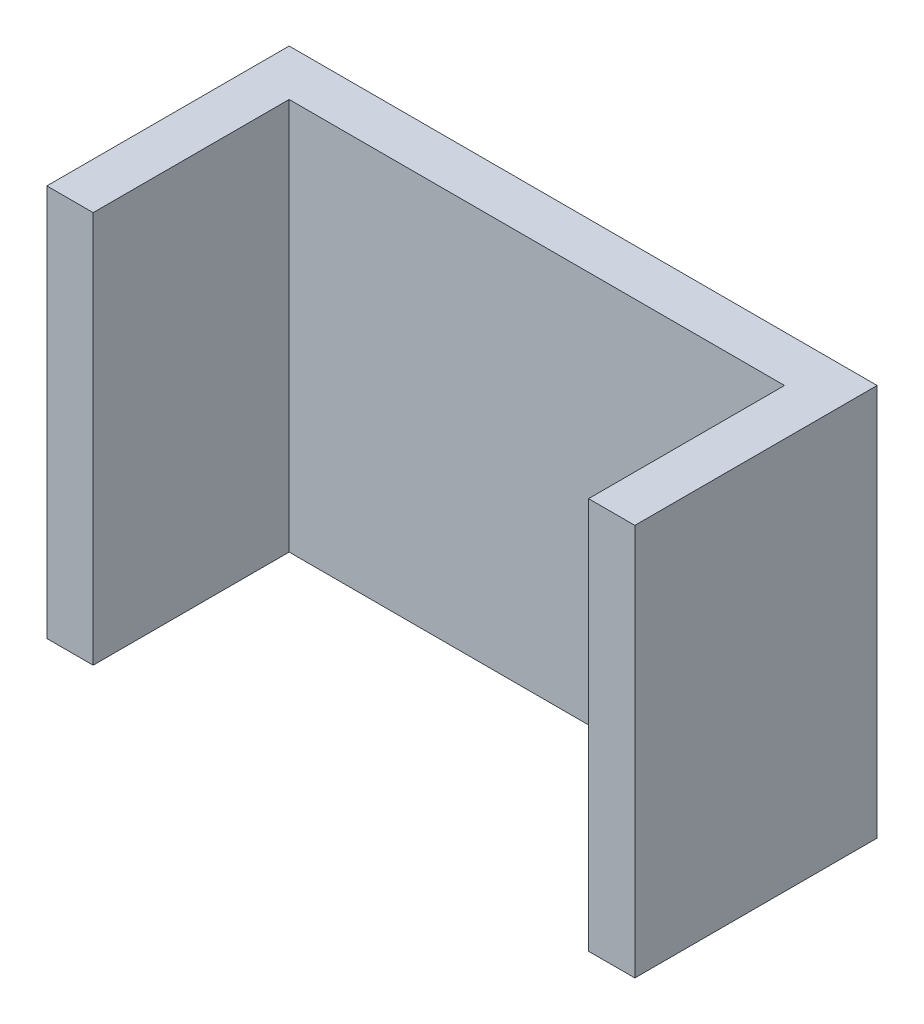
from build123d import *

# Parameters (mm, degrees)
SKETCH3_W           = 6
SKETCH3_H           = 25.4
SKETCH3_W_2         = 76.2
SKETCH3_H_2         = 6
BOSS_EXTRUDE1_DEPTH = 50.8


with BuildPart() as part:
    # Sketch3 → Boss-Extrude1 (new body)
    with BuildSketch(Plane(origin=(0, 0, 0), x_dir=(1, 0, 0), z_dir=(0, 1, 0))):
        with Locations((-35.1, -15.7)):
            Rectangle(SKETCH3_W, SKETCH3_H)
        Rectangle(SKETCH3_W_2, SKETCH3_H_2)
        with Locations((35.1, -15.7)):
            Rectangle(SKETCH3_W, SKETCH3_H)
    extrude(amount=BOSS_EXTRUDE1_DEPTH)


solid = part.part
